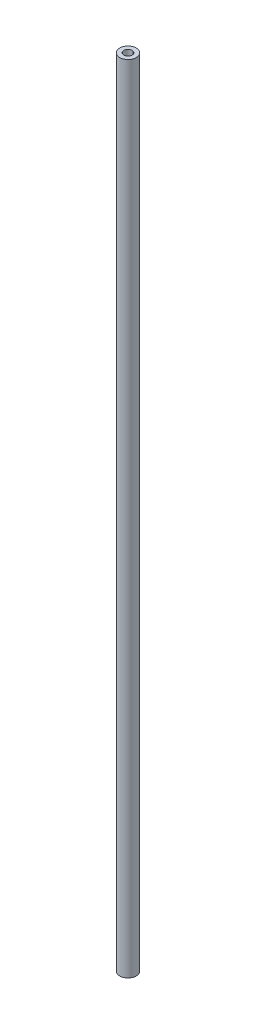
from build123d import *

# Parameters (mm, degrees)
SKETCH1_R           = 6.35
BOSS_EXTRUDE1_DEPTH = 609.6
CUT_EXTRUDE1_REACH  = 611.666
SKETCH2_R           = 3.175


with BuildPart() as part:
    # Sketch1 → Boss-Extrude1 (new body)
    with BuildSketch(Plane(origin=(0, 0, 0), x_dir=(1, 0, 0), z_dir=(0, 1, 0))):
        with Locations(Location((0, 0, 0), (0, 0, 90))):
            Circle(SKETCH1_R)
    extrude(amount=BOSS_EXTRUDE1_DEPTH)

    # Sketch2 → Cut-Extrude1 (cut, up to next)
    with BuildSketch(Plane(origin=(0, 609.6, 0), x_dir=(1, 0, 0), z_dir=(0, 1, 0)), mode=Mode.PRIVATE) as cut_extrude1_sk1:
        with Locations(Location((0, 0, 0), (0, 0, 270))):
            Circle(SKETCH2_R)
    cut_extrude1_tool1 = extrude(cut_extrude1_sk1.sketch, amount=-CUT_EXTRUDE1_REACH, mode=Mode.PRIVATE) & part.part
    add(cut_extrude1_tool1.solids().sort_by_distance((0, 609.6, 0))[0], mode=Mode.SUBTRACT)


solid = part.part
